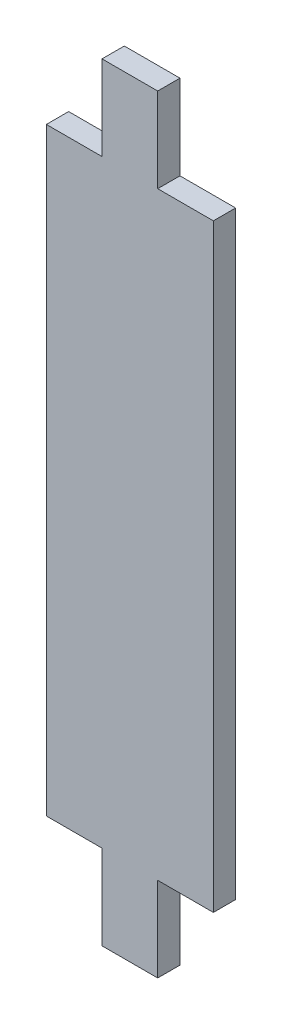
from build123d import *

# Parameters (mm, degrees)
SKETCH_1_W          = 15
SKETCH_1_H          = 2
EXTRUDE_1_DEPTH     = 69
SKETCH_2_W          = 5
SKETCH_2_H          = 7.6
CUT_EXTRUDE_1_DEPTH = 69


with BuildPart() as part:
    # 草图1 → 凸台-拉伸1 (new body)
    with BuildSketch(Plane(origin=(0, 0, 0), x_dir=(1, 0, 0), z_dir=(0, 1, 0))):
        with Locations((-3.209876543, -1)):
            Rectangle(SKETCH_1_W, SKETCH_1_H)
    extrude(amount=EXTRUDE_1_DEPTH)

    # 草图2 → 切除-拉伸1 (cut)
    with BuildSketch(Plane(origin=(0, 0, 0), x_dir=(-1, 0, 0), z_dir=(0, 0, -1))):
        with Locations((8.209876543, 65.2)):
            Rectangle(SKETCH_2_W, SKETCH_2_H)
        with Locations((-1.790123457, 3.8)):
            Rectangle(SKETCH_2_W, SKETCH_2_H)
        with Locations((8.209876543, 3.8)):
            Rectangle(SKETCH_2_W, SKETCH_2_H)
        with Locations((-1.790123457, 65.2)):
            Rectangle(SKETCH_2_W, SKETCH_2_H)
    extrude(amount=-CUT_EXTRUDE_1_DEPTH, mode=Mode.SUBTRACT)


solid = part.part
